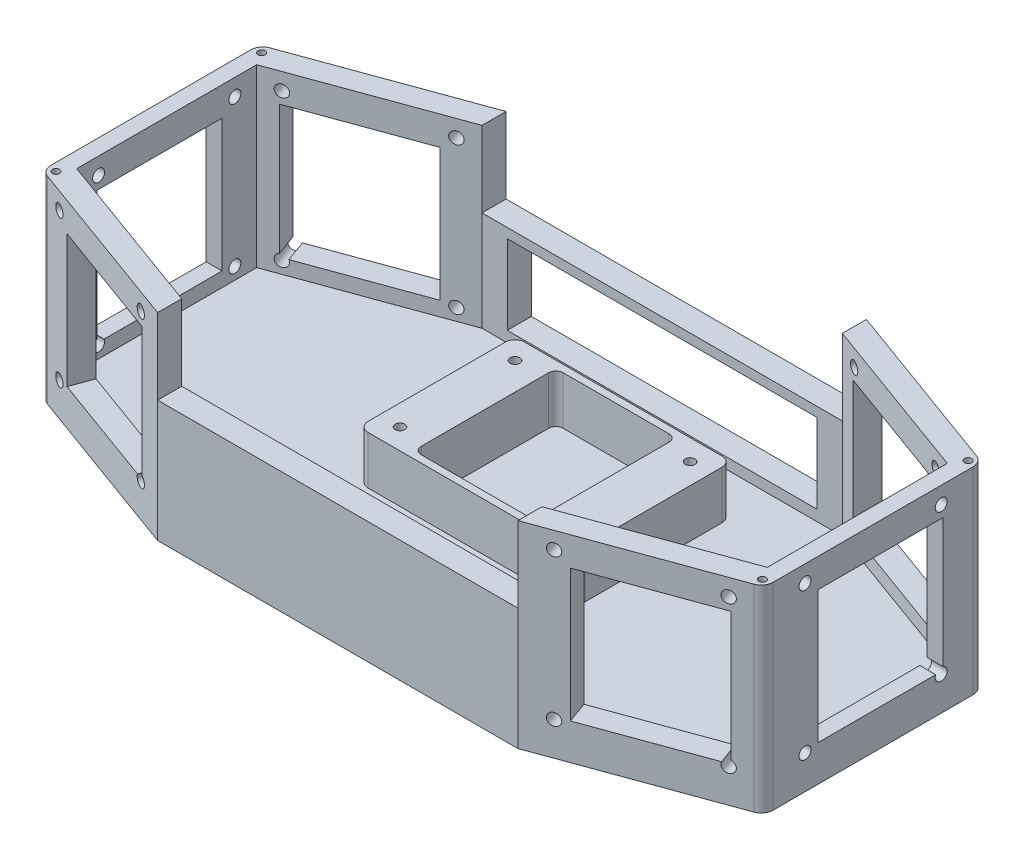
from build123d import *

# Parameters (mm, degrees)
BOSS_EXTRUDE1_DEPTH     = 8
SKETCH2_W               = 10.5
SKETCH2_H               = 10
BOSS_EXTRUDE2_DEPTH     = 37.5
SKETCH4_W               = 128.649180674
SKETCH4_H               = 10
BOSS_EXTRUDE4_DEPTH     = 4.5
BOSS_EXTRUDE5_DEPTH     = 10
SKETCH6_W               = 149.649180674
SKETCH6_H               = 10
BOSS_EXTRUDE6_DEPTH     = 4
CUT_EXTRUDE1_REACH      = 249.54
SKETCH7_R               = 2.5
MIRROR2_COPY_1_REACH    = 249.54
MIRROR2_COPY_1_SKETCH_R = 2.5
CUT_EXTRUDE2_REACH      = 314.548
SKETCH8_R               = 2.5
BOSS_EXTRUDE8_DEPTH     = 63
CUT_EXTRUDE3_REACH      = 257.708
SKETCH10_R              = 2.5
MIRROR5_COPY_1_REACH    = 257.708
MIRROR5_COPY_1_SKETCH_R = 2.5
CUT_EXTRUDE4_REACH      = 321.057
SKETCH11_R              = 2.5
SKETCH12_W              = 6.577848346
SKETCH12_H              = 46
BOSS_EXTRUDE9_DEPTH     = 12
BOSS_EXTRUDE10_DEPTH    = 20
SKETCH14_R              = 2
CUT_EXTRUDE5_DEPTH      = 10
SKETCH15_W              = 149.649180674
SKETCH15_H              = 10
BOSS_EXTRUDE11_DEPTH    = 41.5
SKETCH17_R              = 1.5
CUT_EXTRUDE6_DEPTH      = 10
ENL_V_START             = -2
ESQUISSE1_W             = 12
ESQUISSE1_H             = 42
ESQUISSE1_W_2           = 42
ESQUISSE1_H_2           = 12
ENL_V_MAT_EXTRU_1_DEPTH = 6
BOSS_EXTRU_1_DEPTH      = 1
CONG_1_R                = 5
ENL_V_MAT_EXTRU_2_DEPTH = 10
ESQUISSE5_W             = 52
ESQUISSE5_H             = 55
ENL_V_MAT_EXTRU_3_DEPTH = 10
ESQUISSE6_W             = 52
ESQUISSE6_H             = 55
ENL_V_MAT_EXTRU_4_DEPTH = 10
ESQUISSE7_W             = 52
ESQUISSE7_H             = 55
ENL_V_MAT_EXTRU_5_DEPTH = 10
ESQUISSE8_W             = 52
ESQUISSE8_H             = 55
ENL_V_MAT_EXTRU_6_DEPTH = 10
ESQUISSE9_W             = 52
ESQUISSE9_H             = 55
ENL_V_MAT_EXTRU_7_DEPTH = 10


with BuildPart() as part:
    # Sketch1 → Boss-Extrude1 (new body)
    with BuildSketch(Plane(origin=(0, 0, 0), x_dir=(1, 0, 0), z_dir=(0, 1, 0))):
        Polygon((-150, 45), (-150, -45), (-74.824590337, -72.361611466), (74.824590337, -72.361611466), (150, -45), (150, 45), (74.824590337, 72.361611466), (-74.824590337, 72.361611466), align=None)
    extrude(amount=BOSS_EXTRUDE1_DEPTH)

    # Sketch2 → Boss-Extrude2 (add)
    with BuildSketch(Plane(origin=(0, 8, 0), x_dir=(1, 0, 0), z_dir=(0, 1, 0))):
        with Locations((69.574590337, 67.361611466)):
            Rectangle(SKETCH2_W, SKETCH2_H)
        with Locations((-69.574590337, 67.361611466)):
            Rectangle(SKETCH2_W, SKETCH2_H)
    extrude(amount=BOSS_EXTRUDE2_DEPTH)

    # Sketch4 → Boss-Extrude4 (add)
    with BuildSketch(Plane(origin=(0, 8, 0), x_dir=(1, 0, 0), z_dir=(0, 1, 0))):
        with Locations((0, 67.361611466)):
            Rectangle(SKETCH4_W, SKETCH4_H)
    extrude(amount=BOSS_EXTRUDE4_DEPTH)

    # Sketch5 → Boss-Extrude5 (add)
    with BuildSketch(Plane(origin=(0, 8, 0), x_dir=(1, 0, 0), z_dir=(0, 1, 0))):
        Polygon((-74.824590337, 62.361611466), (-87.040594407, 57.915349603), (-140.603073792, 38.420201433), (-143.422151654, 37.394141003), (-143.422151654, -37.394141003), (-140.603073792, -38.420201433), (-87.040594407, -57.915349603), (-74.824590337, -62.361611466), (-74.824590337, -72.361611466), (-150, -45), (-150, 45), (-74.824590337, 72.361611466), align=None)
        Polygon((150, 45), (150, -45), (74.824590337, -72.361611466), (74.824590337, -62.361611466), (87.040594407, -57.915349603), (140.603073792, -38.420201433), (143.422151654, -37.394141003), (143.422151654, 37.394141003), (140.603073792, 38.420201433), (87.040594407, 57.915349603), (74.824590337, 62.361611466), (74.824590337, 72.361611466), align=None)
    extrude(amount=BOSS_EXTRUDE5_DEPTH)

    # Sketch6 → Boss-Extrude6 (add)
    with BuildSketch(Plane(origin=(0, 45.5, 0), x_dir=(1, 0, 0), z_dir=(0, 1, 0))):
        with Locations((0, 67.361611466)):
            Rectangle(SKETCH6_W, SKETCH6_H)
    extrude(amount=BOSS_EXTRUDE6_DEPTH)

    # Sketch7 → Cut-Extrude1 (cut, up to next)
    with BuildSketch(Plane(origin=(32.009387984, 0, -87.945070697), x_dir=(-0.9396926207859068, 0, -0.3420201433256732), z_dir=(0.3420201433256732, 0, -0.9396926207859068)), mode=Mode.PRIVATE) as cut_extrude1_sk1:
        with Locations((-113.852986668, 13)):
            Circle(SKETCH7_R)
    cut_extrude1_tool1 = extrude(cut_extrude1_sk1.sketch, amount=-CUT_EXTRUDE1_REACH, mode=Mode.PRIVATE) & part.part
    # Sketch7 → Cut-Extrude1 (cut, up to next)
    with BuildSketch(Plane(origin=(32.009387984, 0, -87.945070697), x_dir=(-0.9396926207859068, 0, -0.3420201433256732), z_dir=(0.3420201433256732, 0, -0.9396926207859068)), mode=Mode.PRIVATE) as cut_extrude1_sk2:
        with Locations((-57.272986668, 13)):
            Circle(SKETCH7_R)
    cut_extrude1_tool2 = extrude(cut_extrude1_sk2.sketch, amount=-CUT_EXTRUDE1_REACH, mode=Mode.PRIVATE) & part.part
    cut_extrude1_1 = cut_extrude1_tool1.solids().sort_by_distance((138.996199, 13, -49.005056))[0]
    add(cut_extrude1_1, mode=Mode.SUBTRACT)
    cut_extrude1_2 = cut_extrude1_tool2.solids().sort_by_distance((85.828391, 13, -68.356556))[0]
    add(cut_extrude1_2, mode=Mode.SUBTRACT)
    cut_extrude1 = cut_extrude1_1 + cut_extrude1_2  # Cut-Extrude1 as one shape, for the pattern or mirror that repeats it

    # Mirror1: Cut-Extrude1 across plane
    add(cut_extrude1.mirror(Plane(origin=(0, 0, 0), x_dir=(0, 0, 1), z_dir=(1, 0, 0))), mode=Mode.SUBTRACT)

    # Mirror2: Cut-Extrude1 across plane
    add(cut_extrude1.mirror(Plane(origin=(0, 0, 0), x_dir=(1, 0, 0), z_dir=(0, 0, -1))), mode=Mode.SUBTRACT)

    # Mirror2 copy 1 sketch → Mirror2 copy 1 (cut, up to next)
    with BuildSketch(Plane(origin=(-32.009387984, 0, 87.945070697), x_dir=(0.9396926207859068, 0, 0.3420201433256732), z_dir=(-0.3420201433256732, 0, 0.9396926207859068)), mode=Mode.PRIVATE) as mirror2_copy_1_sk1:
        with Locations((-113.852986668, 13)):
            Circle(MIRROR2_COPY_1_SKETCH_R)
    mirror2_copy_1_tool1 = extrude(mirror2_copy_1_sk1.sketch, amount=-MIRROR2_COPY_1_REACH, mode=Mode.PRIVATE) & part.part
    # Mirror2 copy 1 sketch → Mirror2 copy 1 (cut, up to next)
    with BuildSketch(Plane(origin=(-32.009387984, 0, 87.945070697), x_dir=(0.9396926207859068, 0, 0.3420201433256732), z_dir=(-0.3420201433256732, 0, 0.9396926207859068)), mode=Mode.PRIVATE) as mirror2_copy_1_sk2:
        with Locations((-57.272986668, 13)):
            Circle(MIRROR2_COPY_1_SKETCH_R)
    mirror2_copy_1_tool2 = extrude(mirror2_copy_1_sk2.sketch, amount=-MIRROR2_COPY_1_REACH, mode=Mode.PRIVATE) & part.part
    add(mirror2_copy_1_tool1.solids().sort_by_distance((-138.996199, 13, 49.005056))[0], mode=Mode.SUBTRACT)
    add(mirror2_copy_1_tool2.solids().sort_by_distance((-85.828391, 13, 68.356556))[0], mode=Mode.SUBTRACT)

    # Sketch8 → Cut-Extrude2 (cut, up to next)
    with BuildSketch(Plane(origin=(150, 0, 0), x_dir=(0, 0, -1), z_dir=(1, 0, 0)), mode=Mode.PRIVATE) as cut_extrude2_sk1:
        with Locations((-28.29, 13)):
            Circle(SKETCH8_R)
    cut_extrude2_tool1 = extrude(cut_extrude2_sk1.sketch, amount=-CUT_EXTRUDE2_REACH, mode=Mode.PRIVATE) & part.part
    # Sketch8 → Cut-Extrude2 (cut, up to next)
    with BuildSketch(Plane(origin=(150, 0, 0), x_dir=(0, 0, -1), z_dir=(1, 0, 0)), mode=Mode.PRIVATE) as cut_extrude2_sk2:
        with Locations((28.29, 13)):
            Circle(SKETCH8_R)
    cut_extrude2_tool2 = extrude(cut_extrude2_sk2.sketch, amount=-CUT_EXTRUDE2_REACH, mode=Mode.PRIVATE) & part.part
    cut_extrude2_1 = cut_extrude2_tool1.solids().sort_by_distance((150, 13, 28.29))[0]
    add(cut_extrude2_1, mode=Mode.SUBTRACT)
    cut_extrude2_2 = cut_extrude2_tool2.solids().sort_by_distance((150, 13, -28.29))[0]
    add(cut_extrude2_2, mode=Mode.SUBTRACT)
    cut_extrude2 = cut_extrude2_1 + cut_extrude2_2  # Cut-Extrude2 as one shape, for the pattern or mirror that repeats it

    # Mirror3: Cut-Extrude2 across plane
    add(cut_extrude2.mirror(Plane(origin=(0, 0, 0), x_dir=(0, 0, 1), z_dir=(1, 0, 0))), mode=Mode.SUBTRACT)

    # Sketch9 → Boss-Extrude8 (add)
    with BuildSketch(Plane(origin=(0, 18, 0), x_dir=(1, 0, 0), z_dir=(0, 1, 0))):
        Polygon((143.422151654, 23), (150, 23), (150, 45), (134.025225447, 50.814342437), (130.811287398, 41.984120221), (143.422151654, 37.394141003), align=None)
        Polygon((74.824590337, 72.361611466), (90.79936489, 66.54726903), (87.585426842, 57.717046814), (74.824590337, 62.361611466), align=None)
        Polygon((-74.824590337, 62.361611466), (-74.824590337, 72.361611466), (-90.79936489, 66.54726903), (-87.585426842, 57.717046814), align=None)
        Polygon((-143.422151654, 37.394141003), (-143.422151654, 23), (-150, 23), (-150, 45), (-134.025225447, 50.814342437), (-130.811287398, 41.984120221), align=None)
        Polygon((143.422151654, -37.394141003), (143.422151654, -23), (150, -23), (150, -45), (134.025225447, -50.814342437), (130.811287398, -41.984120221), align=None)
        Polygon((-143.422151654, -23), (-150, -23), (-150, -45), (-134.025225447, -50.814342437), (-130.811287398, -41.984120221), (-143.422151654, -37.394141003), align=None)
        Polygon((-74.824590337, -72.361611466), (-90.79936489, -66.54726903), (-87.585426842, -57.717046814), (-74.824590337, -62.361611466), align=None)
        Polygon((74.824590337, -62.361611466), (74.824590337, -72.361611466), (90.79936489, -66.54726903), (87.585426842, -57.717046814), align=None)
    extrude(amount=BOSS_EXTRUDE8_DEPTH)

    # Sketch10 → Cut-Extrude3 (cut, up to next)
    with BuildSketch(Plane(origin=(32.009387984, 0, -87.945070697), x_dir=(-0.9396926207859068, 0, -0.3420201433256732), z_dir=(0.3420201433256732, 0, -0.9396926207859068)), mode=Mode.PRIVATE) as cut_extrude3_sk1:
        with Locations((-113.852986668, 74)):
            Circle(SKETCH10_R)
    cut_extrude3_tool1 = extrude(cut_extrude3_sk1.sketch, amount=-CUT_EXTRUDE3_REACH, mode=Mode.PRIVATE) & part.part
    # Sketch10 → Cut-Extrude3 (cut, up to next)
    with BuildSketch(Plane(origin=(32.009387984, 0, -87.945070697), x_dir=(-0.9396926207859068, 0, -0.3420201433256732), z_dir=(0.3420201433256732, 0, -0.9396926207859068)), mode=Mode.PRIVATE) as cut_extrude3_sk2:
        with Locations((-57.272986668, 74)):
            Circle(SKETCH10_R)
    cut_extrude3_tool2 = extrude(cut_extrude3_sk2.sketch, amount=-CUT_EXTRUDE3_REACH, mode=Mode.PRIVATE) & part.part
    cut_extrude3_1 = cut_extrude3_tool1.solids().sort_by_distance((138.996199, 74, -49.005056))[0]
    add(cut_extrude3_1, mode=Mode.SUBTRACT)
    cut_extrude3_2 = cut_extrude3_tool2.solids().sort_by_distance((85.828391, 74, -68.356556))[0]
    add(cut_extrude3_2, mode=Mode.SUBTRACT)
    cut_extrude3 = cut_extrude3_1 + cut_extrude3_2  # Cut-Extrude3 as one shape, for the pattern or mirror that repeats it

    # Mirror4: Cut-Extrude3 across plane
    add(cut_extrude3.mirror(Plane(origin=(0, 0, 0), x_dir=(0, 0, 1), z_dir=(1, 0, 0))), mode=Mode.SUBTRACT)

    # Mirror5: Cut-Extrude3 across plane
    add(cut_extrude3.mirror(Plane(origin=(0, 0, 0), x_dir=(1, 0, 0), z_dir=(0, 0, -1))), mode=Mode.SUBTRACT)

    # Mirror5 copy 1 sketch → Mirror5 copy 1 (cut, up to next)
    with BuildSketch(Plane(origin=(-32.009387984, 0, 87.945070697), x_dir=(0.9396926207859068, 0, 0.3420201433256732), z_dir=(-0.3420201433256732, 0, 0.9396926207859068)), mode=Mode.PRIVATE) as mirror5_copy_1_sk1:
        with Locations((-113.852986668, 74)):
            Circle(MIRROR5_COPY_1_SKETCH_R)
    mirror5_copy_1_tool1 = extrude(mirror5_copy_1_sk1.sketch, amount=-MIRROR5_COPY_1_REACH, mode=Mode.PRIVATE) & part.part
    # Mirror5 copy 1 sketch → Mirror5 copy 1 (cut, up to next)
    with BuildSketch(Plane(origin=(-32.009387984, 0, 87.945070697), x_dir=(0.9396926207859068, 0, 0.3420201433256732), z_dir=(-0.3420201433256732, 0, 0.9396926207859068)), mode=Mode.PRIVATE) as mirror5_copy_1_sk2:
        with Locations((-57.272986668, 74)):
            Circle(MIRROR5_COPY_1_SKETCH_R)
    mirror5_copy_1_tool2 = extrude(mirror5_copy_1_sk2.sketch, amount=-MIRROR5_COPY_1_REACH, mode=Mode.PRIVATE) & part.part
    add(mirror5_copy_1_tool1.solids().sort_by_distance((-138.996199, 74, 49.005056))[0], mode=Mode.SUBTRACT)
    add(mirror5_copy_1_tool2.solids().sort_by_distance((-85.828391, 74, 68.356556))[0], mode=Mode.SUBTRACT)

    # Sketch11 → Cut-Extrude4 (cut, up to next)
    with BuildSketch(Plane(origin=(150, 0, 0), x_dir=(0, 0, -1), z_dir=(1, 0, 0)), mode=Mode.PRIVATE) as cut_extrude4_sk1:
        with Locations((-28.29, 74)):
            Circle(SKETCH11_R)
    cut_extrude4_tool1 = extrude(cut_extrude4_sk1.sketch, amount=-CUT_EXTRUDE4_REACH, mode=Mode.PRIVATE) & part.part
    # Sketch11 → Cut-Extrude4 (cut, up to next)
    with BuildSketch(Plane(origin=(150, 0, 0), x_dir=(0, 0, -1), z_dir=(1, 0, 0)), mode=Mode.PRIVATE) as cut_extrude4_sk2:
        with Locations((28.29, 74)):
            Circle(SKETCH11_R)
    cut_extrude4_tool2 = extrude(cut_extrude4_sk2.sketch, amount=-CUT_EXTRUDE4_REACH, mode=Mode.PRIVATE) & part.part
    cut_extrude4_1 = cut_extrude4_tool1.solids().sort_by_distance((150, 74, 28.29))[0]
    add(cut_extrude4_1, mode=Mode.SUBTRACT)
    cut_extrude4_2 = cut_extrude4_tool2.solids().sort_by_distance((150, 74, -28.29))[0]
    add(cut_extrude4_2, mode=Mode.SUBTRACT)
    cut_extrude4 = cut_extrude4_1 + cut_extrude4_2  # Cut-Extrude4 as one shape, for the pattern or mirror that repeats it

    # Mirror6: Cut-Extrude4 across plane
    add(cut_extrude4.mirror(Plane(origin=(0, 0, 0), x_dir=(0, 0, 1), z_dir=(1, 0, 0))), mode=Mode.SUBTRACT)

    # Sketch12 → Boss-Extrude9 (add)
    with BuildSketch(Plane(origin=(0, 81, 0), x_dir=(1, 0, 0), z_dir=(0, 1, 0))):
        Polygon((130.811287398, 41.984120221), (87.585426842, 57.717046814), (90.79936489, 66.54726903), (134.025225447, 50.814342437), align=None)
        with Locations((146.711075827, 0)):
            Rectangle(SKETCH12_W, SKETCH12_H)
        Polygon((134.025225447, -50.814342437), (130.811287398, -41.984120221), (87.585426842, -57.717046814), (90.79936489, -66.54726903), align=None)
        Polygon((-130.811287398, -41.984120221), (-87.585426842, -57.717046814), (-90.79936489, -66.54726903), (-134.025225447, -50.814342437), align=None)
        with Locations((-146.711075827, 0)):
            Rectangle(SKETCH12_W, SKETCH12_H)
        Polygon((-134.025225447, 50.814342437), (-130.811287398, 41.984120221), (-87.585426842, 57.717046814), (-90.79936489, 66.54726903), align=None)
    extrude(amount=-BOSS_EXTRUDE9_DEPTH)

    # Sketch13 → Boss-Extrude10 (add)
    with BuildSketch(Plane(origin=(0, 8, 0), x_dir=(1, 0, 0), z_dir=(0, 1, 0))):
        with BuildLine():
            Line((-41, 46.231611466), (-29, 46.231611466))
            Line((-29, 46.231611466), (29, 46.231611466))
            Line((29, 46.231611466), (41, 46.231611466))
            ThreePointArc((41, 46.231611466), (43.828427125, 45.060038591), (45, 42.231611466))
            Line((45, 42.231611466), (45, -14.768388534))
            ThreePointArc((45, -14.768388534), (43.828427125, -17.596815659), (41, -18.768388534))
            Line((41, -18.768388534), (29, -18.768388534))
            Line((29, -18.768388534), (-29, -18.768388534))
            Line((-29, -18.768388534), (-41, -18.768388534))
            ThreePointArc((-41, -18.768388534), (-43.828427125, -17.596815659), (-45, -14.768388534))
            Line((-45, -14.768388534), (-45, 42.231611466))
            ThreePointArc((-45, 42.231611466), (-43.828427125, 45.060038591), (-41, 46.231611466))
        make_face()
        with BuildLine():
            Line((-25, 40.231611466), (-25, -12.768388534))
            ThreePointArc((-25, -12.768388534), (-24.121320344, -14.889708878), (-22, -15.768388534))
            Line((-22, -15.768388534), (22, -15.768388534))
            ThreePointArc((22, -15.768388534), (24.121320344, -14.889708878), (25, -12.768388534))
            Line((25, -12.768388534), (25, 40.231611466))
            ThreePointArc((25, 40.231611466), (24.121320344, 42.35293181), (22, 43.231611466))
            Line((22, 43.231611466), (-22, 43.231611466))
            ThreePointArc((-22, 43.231611466), (-24.121320344, 42.35293181), (-25, 40.231611466))
        make_face(mode=Mode.SUBTRACT)
    extrude(amount=BOSS_EXTRUDE10_DEPTH)

    # Sketch14 → Cut-Extrude5 (cut)
    with BuildSketch(Plane(origin=(0, 28, 0), x_dir=(1, 0, 0), z_dir=(0, 1, 0))):
        with Locations(Location((-36.37, 37.606611466, 0), (0, 0, 270))):
            Circle(SKETCH14_R)
        with Locations(Location((-36.37, -10.143388534, 0), (0, 0, 270))):
            Circle(SKETCH14_R)
    cut_extrude5 = extrude(amount=-CUT_EXTRUDE5_DEPTH, mode=Mode.SUBTRACT)

    # Mirror7: Cut-Extrude5 across plane
    add(cut_extrude5.mirror(Plane(origin=(0, 0, 0), x_dir=(0, 0, 1), z_dir=(1, 0, 0))), mode=Mode.SUBTRACT)

    # Sketch15 → Boss-Extrude11 (add)
    with BuildSketch(Plane(origin=(0, 8, 0), x_dir=(1, 0, 0), z_dir=(0, 1, 0))):
        with Locations((0, -67.361611466)):
            Rectangle(SKETCH15_W, SKETCH15_H)
    extrude(amount=BOSS_EXTRUDE11_DEPTH)

    # Sketch17 → Cut-Extrude6 (cut)
    with BuildSketch(Plane(origin=(0, 81, 0), x_dir=(1, 0, 0), z_dir=(0, 1, 0))):
        with Locations(Location((146.723391823, -42.705694255, 0), (0, 0, 270))):
            Circle(SKETCH17_R)
        with Locations(Location((146.723391823, 42.705694255, 0), (0, 0, 90))):
            Circle(SKETCH17_R)
        with Locations(Location((-146.723391823, 42.705694255, 0), (0, 0, 270))):
            Circle(SKETCH17_R)
        with Locations(Location((-146.723391823, -42.705694255, 0), (0, 0, 90))):
            Circle(SKETCH17_R)
    extrude(amount=-CUT_EXTRUDE6_DEPTH, mode=Mode.SUBTRACT)

    # Esquisse1 → Enlèv. mat.-Extru.1 (cut)
    with BuildSketch(Plane(origin=(0, 8, 0), x_dir=(1, 0, 0), z_dir=(0, 1, 0)).offset(ENL_V_START)):
        with Locations((-126, 0)):
            Rectangle(ESQUISSE1_W, ESQUISSE1_H)
        with Locations((126, 0)):
            Rectangle(ESQUISSE1_W, ESQUISSE1_H)
        with Locations((-74.824590337, 25)):
            Rectangle(ESQUISSE1_W_2, ESQUISSE1_H_2)
        with Locations((-74.824590337, -25)):
            Rectangle(ESQUISSE1_W_2, ESQUISSE1_H_2)
        with Locations((74.824590337, -25)):
            Rectangle(ESQUISSE1_W_2, ESQUISSE1_H_2)
        with Locations((74.824590337, 25)):
            Rectangle(ESQUISSE1_W_2, ESQUISSE1_H_2)
    extrude(amount=-ENL_V_MAT_EXTRU_1_DEPTH, mode=Mode.SUBTRACT)

    # Esquisse2 → Boss.-Extru.1 (add)
    with BuildSketch(Plane.XZ):
        Polygon((-150, -45), (-74.824590337, -72.361611466), (74.824590337, -72.361611466), (150, -45), (150, 45), (74.824590337, 72.361611466), (-74.824590337, 72.361611466), (-150, 45), align=None)
    extrude(amount=BOSS_EXTRU_1_DEPTH)

    # Congé1
    cong_1_edges = [part.edges().sort_by_distance(p)[0] for p in [
        (150, 40, -45),
        (150, 40, 45),
        (-150, 40, 45),
        (-150, 40, -45),
    ]]
    fillet(cong_1_edges, radius=CONG_1_R)

    # Esquisse3 → Enlèv. mat.-Extru.2 (cut)
    with BuildSketch(Plane(origin=(-32.009387984, 0, 87.945070697), x_dir=(0.9396926207859068, 0, 0.34202014332567315), z_dir=(-0.34202014332567315, 0, 0.9396926207859069))):
        with BuildLine():
            Line((-56.562986668, 69), (-62.562986668, 69))
            Line((-62.562986668, 69), (-62.562986668, 18))
            Line((-62.562986668, 18), (-108.562986668, 18))
            Line((-108.562986668, 18), (-108.562986668, 14))
            Line((-108.562986668, 14), (-59.564274516, 14))
            ThreePointArc((-59.564274516, 14), (-58.328004424, 15.266481312), (-56.562986668, 15.3970607))
            Line((-56.562986668, 15.3970607), (-56.562986668, 69))
        make_face()
    extrude(amount=-ENL_V_MAT_EXTRU_2_DEPTH, mode=Mode.SUBTRACT)

    # Esquisse5 → Enlèv. mat.-Extru.3 (cut)
    with BuildSketch(Plane.ZY.offset(150)):
        with Locations((3, 41.5)):
            Rectangle(ESQUISSE5_W, ESQUISSE5_H)
    extrude(amount=-ENL_V_MAT_EXTRU_3_DEPTH, mode=Mode.SUBTRACT)

    # Esquisse6 → Enlèv. mat.-Extru.4 (cut)
    with BuildSketch(Plane(origin=(-32.009387984, 0, -87.945070697), x_dir=(-0.9396926207859068, 0, 0.34202014332567315), z_dir=(-0.34202014332567315, 0, -0.9396926207859069))):
        with Locations((88.562986668, 41.5)):
            Rectangle(ESQUISSE6_W, ESQUISSE6_H)
    extrude(amount=-ENL_V_MAT_EXTRU_4_DEPTH, mode=Mode.SUBTRACT)

    # Esquisse7 → Enlèv. mat.-Extru.5 (cut)
    with BuildSketch(Plane(origin=(32.009387984, 0, -87.945070697), x_dir=(-0.9396926207859068, 0, -0.3420201433256732), z_dir=(0.3420201433256732, 0, -0.9396926207859068))):
        with Locations((-82.562986668, 41.5)):
            Rectangle(ESQUISSE7_W, ESQUISSE7_H)
    extrude(amount=-ENL_V_MAT_EXTRU_5_DEPTH, mode=Mode.SUBTRACT)

    # Esquisse8 → Enlèv. mat.-Extru.6 (cut)
    with BuildSketch(Plane(origin=(150, 0, 0), x_dir=(0, 0, -1), z_dir=(1, 0, 0))):
        with Locations((3, 41.5)):
            Rectangle(ESQUISSE8_W, ESQUISSE8_H)
    extrude(amount=-ENL_V_MAT_EXTRU_6_DEPTH, mode=Mode.SUBTRACT)

    # Esquisse9 → Enlèv. mat.-Extru.7 (cut)
    with BuildSketch(Plane(origin=(32.009387984, 0, 87.945070697), x_dir=(0.9396926207859068, 0, -0.3420201433256732), z_dir=(0.3420201433256732, 0, 0.9396926207859068))):
        with Locations((88.562986668, 41.5)):
            Rectangle(ESQUISSE9_W, ESQUISSE9_H)
    extrude(amount=-ENL_V_MAT_EXTRU_7_DEPTH, mode=Mode.SUBTRACT)


solid = part.part
